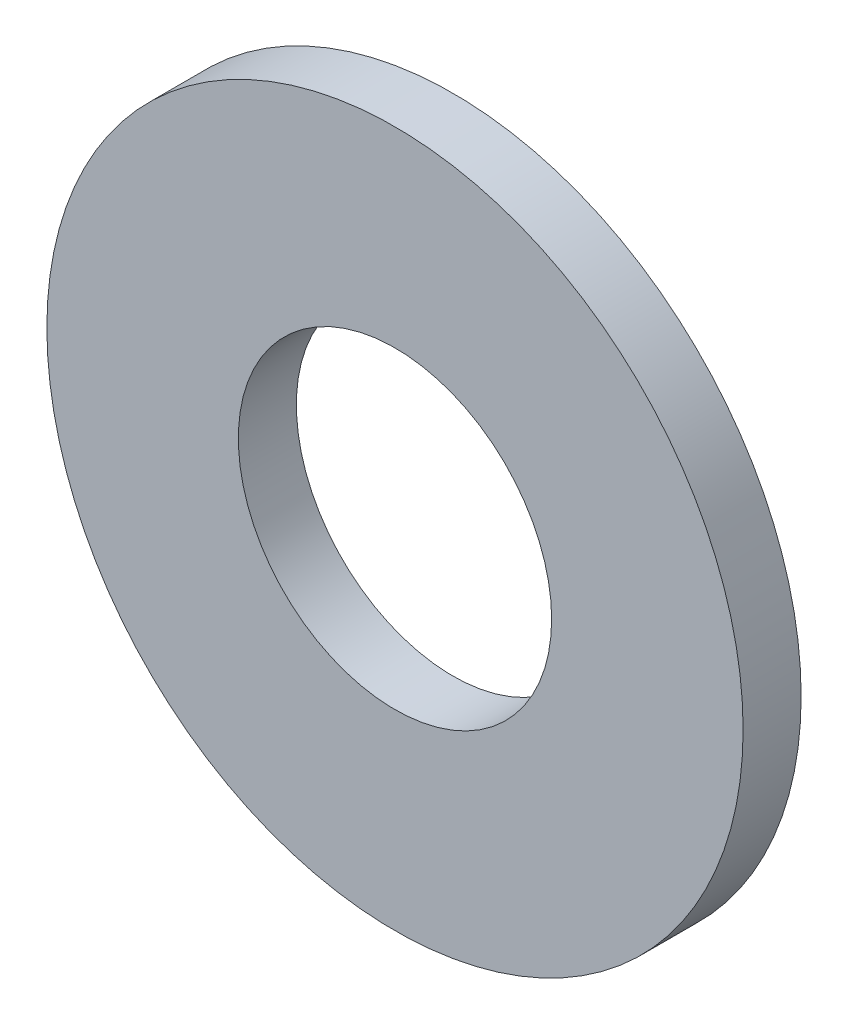
from build123d import *

# Parameters (mm, degrees)
SKETCH1_R             = 3
SKETCH1_R_2           = 1.35
WASHER_ENVELOPE_DEPTH = 0.5


with BuildPart() as part:
    # Sketch1 → Washer_Envelope (new body)
    with BuildSketch(Plane.XY):
        Circle(SKETCH1_R)
        Circle(SKETCH1_R_2, mode=Mode.SUBTRACT)
    extrude(amount=WASHER_ENVELOPE_DEPTH)


solid = part.part
